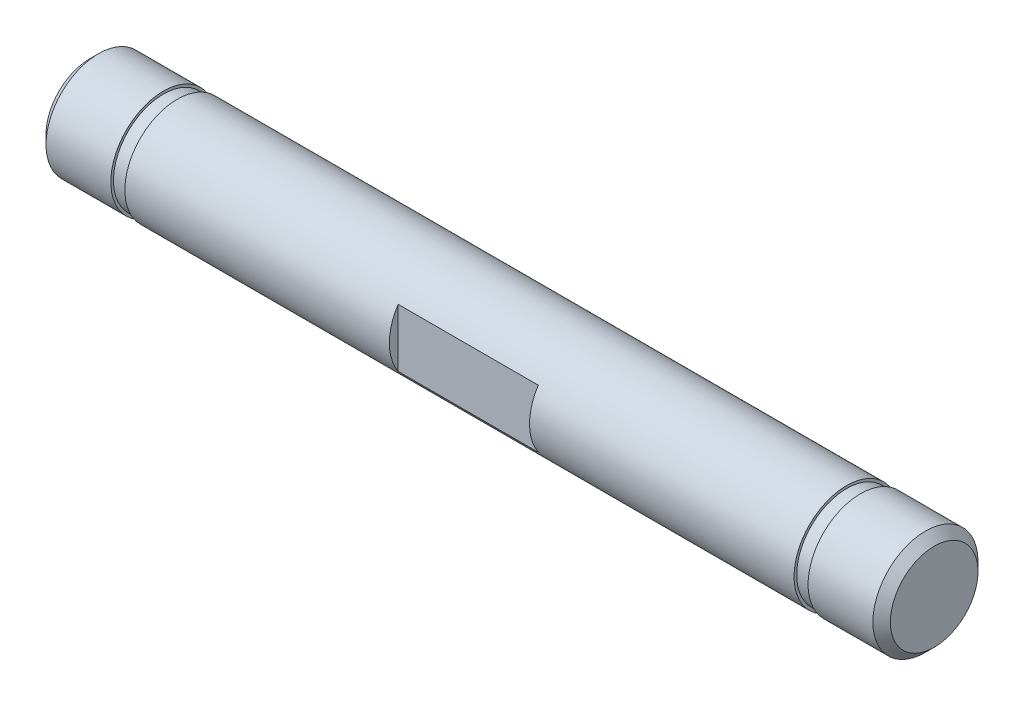
from build123d import *

# Parameters (mm, degrees)
CORTAR_EXTRUIR1_DEPTH = 4
CHAFL_N1_SIZE         = 0.5


with BuildPart() as part:
    # Croquis1 → Revolución1 (revolve)
    with BuildSketch(Plane(origin=(0, 0, 0), x_dir=(-1, 0, 0), z_dir=(0, 1, 0)), mode=Mode.PRIVATE) as revoluci_n1_sk:
        Polygon((-19.1, 3), (19.1, 3), (19.1, 2.85), (19.9, 2.85), (19.9, 3), (24.1, 3), (24.1, 0), (-24.1, 0), (-24.1, 3), (-19.9, 3), (-19.9, 2.85), (-19.1, 2.85), align=None)
    revolve(revoluci_n1_sk.sketch.rotate(Axis((24.1, 0, 0), (-1, 0, 0)), 180), axis=Axis((24.1, 0, 0), (-1, 0, 0)))

    # Croquis2 → Cortar-Extruir1 (cut, symmetric)
    with BuildSketch(Plane.YZ):
        with BuildLine():
            Line((1.658312395, 2.5), (-1.658312395, 2.5))
            ThreePointArc((-1.658312395, 2.5), (0, 3), (1.658312395, 2.5))
        make_face()
    extrude(amount=CORTAR_EXTRUIR1_DEPTH, both=True, mode=Mode.SUBTRACT)

    # Chaflán1
    chafl_n1_edges = [part.edges().sort_by_distance(p)[0] for p in [
        (24.1, 0, 3),
        (-24.1, 0, 3),
    ]]
    chamfer(chafl_n1_edges, length=CHAFL_N1_SIZE)


solid = part.part
